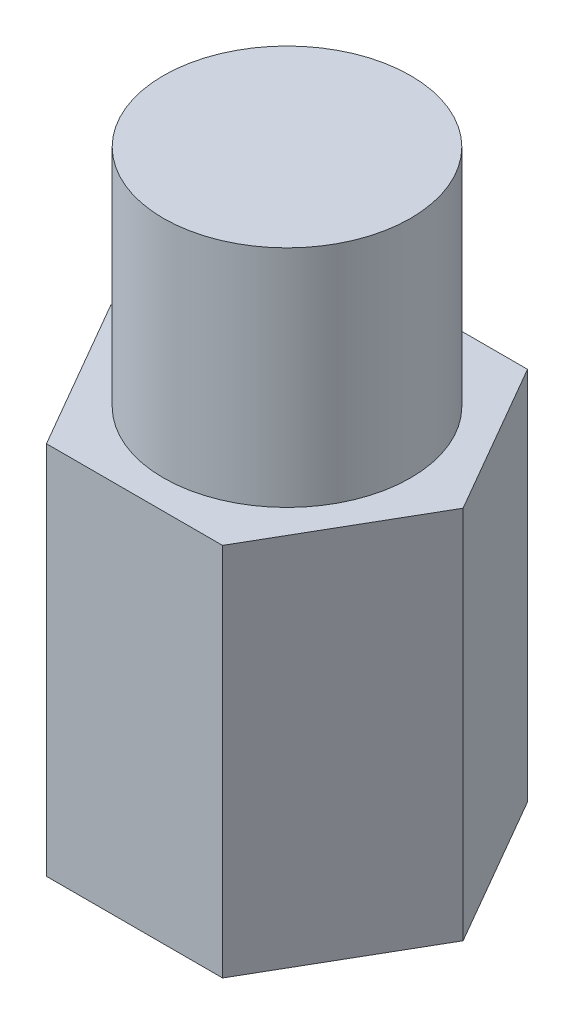
from build123d import *

# Parameters (mm, degrees)
EXTRUDE_1_DEPTH     = 5
SKETCH_2_R          = 1.65
EXTRUDE_2_DEPTH     = 3
SKETCH_3_R          = 1.65
CUT_EXTRUDE_1_DEPTH = 3


with BuildPart() as part:
    # 草图1 → 凸台-拉伸1 (new body)
    with BuildSketch(Plane(origin=(0, 0, 0), x_dir=(1, 0, 0), z_dir=(0, 1, 0))):
        Polygon((1.175, -2.035159699), (2.35, 0), (1.175, 2.035159699), (-1.175, 2.035159699), (-2.35, 0), (-1.175, -2.035159699), align=None)
    extrude(amount=EXTRUDE_1_DEPTH)

    # 草图2 → 凸台-拉伸2 (add)
    with BuildSketch(Plane(origin=(0, 5, 0), x_dir=(1, 0, 0), z_dir=(0, 1, 0))):
        with Locations(Location((0, 0, 0), (0, 0, 270))):
            Circle(SKETCH_2_R)
    extrude(amount=EXTRUDE_2_DEPTH)

    # 草图3 → 切除-拉伸1 (cut)
    with BuildSketch(Plane.XZ):
        with Locations(Location((0, 0, 0), (0, 0, 90))):
            Circle(SKETCH_3_R)
    extrude(amount=-CUT_EXTRUDE_1_DEPTH, mode=Mode.SUBTRACT)


solid = part.part
